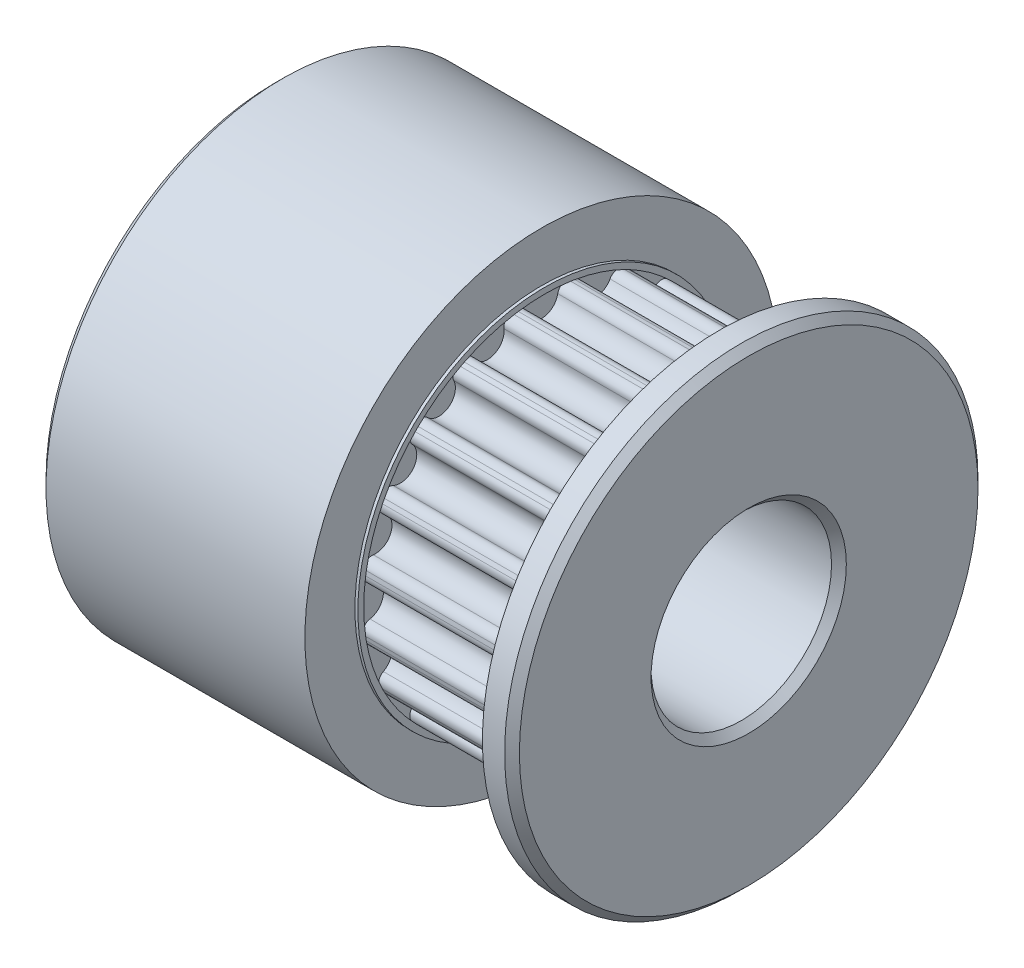
from build123d import *

# Parameters (mm, degrees)
BOSS_EXTRUDE1_DEPTH     = 6
FILLET1_R               = 0.3
SKETCH2_R               = 8
BOSS_EXTRUDE2_DEPTH     = 9
BOSS_EXTRUDE3_START     = 1
SKETCH3_R               = 8
BOSS_EXTRUDE3_DEPTH     = 1
CUT_EXTRUDE1_DEPTH      = 15.456832405
CUT_EXTRUDE1_DEPTH_BACK = 15.456832405
SKETCH4_R               = 3.05
CHAMFER1_SIZE           = 0.25
SKETCH5_R               = 1.75
CUT_EXTRUDE2_DEPTH      = 15.456832405
SKETCH6_R               = 1.75
CUT_EXTRUDE3_DEPTH      = 15.456832405
SKETCH12_R              = 6.31
SKETCH12_R_2            = 6.11
BOSS_EXTRUDE4_DEPTH     = 0.1


with BuildPart() as part:
    # Sketch1 → Boss-Extrude1 (new body)
    with BuildSketch(Plane(origin=(0, 0, 0), x_dir=(0, 0, -1), z_dir=(1, 0, 0))):
        with BuildLine():
            ThreePointArc((0.5225186, -6.087616472), (0.955814581, -6.034775761), (1.384232226, -5.951134442))
            ThreePointArc((1.384232226, -5.951134442), (1.651861295, -5.083906312), (2.378121664, -5.628200187))
            ThreePointArc((2.378121664, -5.628200187), (2.773881953, -5.444049863), (3.155484757, -5.232113908))
            ThreePointArc((3.155484757, -5.232113908), (3.142026897, -4.324629014), (4.000937611, -4.617856454))
            ThreePointArc((4.000937611, -4.617856454), (4.320422433, -4.320422433), (4.617856454, -4.000937611))
            ThreePointArc((4.617856454, -4.000937611), (4.324629014, -3.142026897), (5.232113908, -3.155484757))
            ThreePointArc((5.232113908, -3.155484757), (5.444049863, -2.773881953), (5.628200187, -2.378121664))
            ThreePointArc((5.628200187, -2.378121664), (5.083906312, -1.651861295), (5.951134442, -1.384232226))
            ThreePointArc((5.951134442, -1.384232226), (6.034775761, -0.955814581), (6.087616472, -0.5225186))
            ThreePointArc((6.087616472, -0.5225186), (5.345535439, 0), (6.087616472, 0.5225186))
            ThreePointArc((6.087616472, 0.5225186), (6.034775761, 0.955814581), (5.951134442, 1.384232226))
            ThreePointArc((5.951134442, 1.384232226), (5.083906312, 1.651861295), (5.628200187, 2.378121664))
            ThreePointArc((5.628200187, 2.378121664), (5.444049863, 2.773881953), (5.232113908, 3.155484757))
            ThreePointArc((5.232113908, 3.155484757), (4.324629014, 3.142026897), (4.617856454, 4.000937611))
            ThreePointArc((4.617856454, 4.000937611), (4.320422433, 4.320422433), (4.000937611, 4.617856454))
            ThreePointArc((4.000937611, 4.617856454), (3.142026897, 4.324629014), (3.155484757, 5.232113908))
            ThreePointArc((3.155484757, 5.232113908), (2.773881953, 5.444049863), (2.378121664, 5.628200187))
            ThreePointArc((2.378121664, 5.628200187), (1.651861295, 5.083906312), (1.384232226, 5.951134442))
            ThreePointArc((1.384232226, 5.951134442), (0.955814581, 6.034775761), (0.5225186, 6.087616472))
            ThreePointArc((0.5225186, 6.087616472), (0, 5.345535439), (-0.5225186, 6.087616472))
            ThreePointArc((-0.5225186, 6.087616472), (-0.955814581, 6.034775761), (-1.384232226, 5.951134442))
            ThreePointArc((-1.384232226, 5.951134442), (-1.651861295, 5.083906312), (-2.378121664, 5.628200187))
            ThreePointArc((-2.378121664, 5.628200187), (-2.773881953, 5.444049863), (-3.155484757, 5.232113908))
            ThreePointArc((-3.155484757, 5.232113908), (-3.142026897, 4.324629014), (-4.000937611, 4.617856454))
            ThreePointArc((-4.000937611, 4.617856454), (-4.320422433, 4.320422433), (-4.617856454, 4.000937611))
            ThreePointArc((-4.617856454, 4.000937611), (-4.324629014, 3.142026897), (-5.232113908, 3.155484757))
            ThreePointArc((-5.232113908, 3.155484757), (-5.444049863, 2.773881953), (-5.628200187, 2.378121664))
            ThreePointArc((-5.628200187, 2.378121664), (-5.083906312, 1.651861295), (-5.951134442, 1.384232226))
            ThreePointArc((-5.951134442, 1.384232226), (-6.034775761, 0.955814581), (-6.087616472, 0.5225186))
            ThreePointArc((-6.087616472, 0.5225186), (-5.345535439, 0), (-6.087616472, -0.5225186))
            ThreePointArc((-6.087616472, -0.5225186), (-6.034775761, -0.955814581), (-5.951134442, -1.384232226))
            ThreePointArc((-5.951134442, -1.384232226), (-5.083906312, -1.651861295), (-5.628200187, -2.378121664))
            ThreePointArc((-5.628200187, -2.378121664), (-5.444049863, -2.773881953), (-5.232113908, -3.155484757))
            ThreePointArc((-5.232113908, -3.155484757), (-4.324629014, -3.142026897), (-4.617856454, -4.000937611))
            ThreePointArc((-4.617856454, -4.000937611), (-4.320422433, -4.320422433), (-4.000937611, -4.617856454))
            ThreePointArc((-4.000937611, -4.617856454), (-3.142026897, -4.324629014), (-3.155484757, -5.232113908))
            ThreePointArc((-3.155484757, -5.232113908), (-2.773881953, -5.444049863), (-2.378121664, -5.628200187))
            ThreePointArc((-2.378121664, -5.628200187), (-1.651861295, -5.083906312), (-1.384232226, -5.951134442))
            ThreePointArc((-1.384232226, -5.951134442), (-0.955814581, -6.034775761), (-0.5225186, -6.087616472))
            ThreePointArc((-0.5225186, -6.087616472), (0, -5.345535439), (0.5225186, -6.087616472))
        make_face()
    extrude(amount=BOSS_EXTRUDE1_DEPTH)

    # Fillet1
    fillet1_edges = [part.edges().sort_by_distance(p)[0] for p in [
        (3, -6.087616472, 0.5225186),
        (3, -5.951134442, 1.384232226),
        (3, -5.628200187, 2.378121664),
        (3, -5.232113908, 3.155484757),
        (3, -4.617856454, 4.000937611),
        (3, -4.000937611, 4.617856454),
        (3, -3.155484757, 5.232113908),
        (3, -2.378121664, 5.628200187),
        (3, -1.384232226, 5.951134442),
        (3, -0.5225186, 6.087616472),
        (3, 0.5225186, 6.087616472),
        (3, 1.384232226, 5.951134442),
        (3, 2.378121664, 5.628200187),
        (3, 3.155484757, 5.232113908),
        (3, 4.000937611, 4.617856454),
        (3, 4.617856454, 4.000937611),
        (3, 5.232113908, 3.155484757),
        (3, 5.628200187, 2.378121664),
        (3, 5.951134442, 1.384232226),
        (3, 6.087616472, 0.5225186),
        (3, 6.087616472, -0.5225186),
        (3, 5.951134442, -1.384232226),
        (3, 5.628200187, -2.378121664),
        (3, 5.232113908, -3.155484757),
        (3, 4.617856454, -4.000937611),
        (3, 4.000937611, -4.617856454),
        (3, 3.155484757, -5.232113908),
        (3, 2.378121664, -5.628200187),
        (3, 1.384232226, -5.951134442),
        (3, 0.5225186, -6.087616472),
        (3, -0.5225186, -6.087616472),
        (3, -1.384232226, -5.951134442),
        (3, -2.378121664, -5.628200187),
        (3, -3.155484757, -5.232113908),
        (3, -4.000937611, -4.617856454),
        (3, -4.617856454, -4.000937611),
        (3, -5.232113908, -3.155484757),
        (3, -5.628200187, -2.378121664),
        (3, -5.951134442, -1.384232226),
        (3, -6.087616472, -0.5225186),
    ]]
    fillet(fillet1_edges, radius=FILLET1_R)

    # Sketch2 → Boss-Extrude2 (add)
    with BuildSketch(Plane(origin=(0, 0, 0), x_dir=(0, 0, -1), z_dir=(1, 0, 0))):
        Circle(SKETCH2_R)
    extrude(amount=-BOSS_EXTRUDE2_DEPTH)

    # Sketch3 → Boss-Extrude3 (add)
    with BuildSketch(Plane(origin=(6, 0, 0), x_dir=(0, 0, -1), z_dir=(1, 0, 0)).offset(BOSS_EXTRUDE3_START)):
        Circle(SKETCH3_R)
    extrude(amount=-BOSS_EXTRUDE3_DEPTH)

    # Sketch4 → Cut-Extrude1 (cut, two sides: drawn at the far end of the back side and taken through both)
    with BuildSketch(Plane(origin=(0, 0, 0), x_dir=(0, 0, -1), z_dir=(1, 0, 0)).offset(-CUT_EXTRUDE1_DEPTH_BACK)):
        Circle(SKETCH4_R)
    extrude(amount=CUT_EXTRUDE1_DEPTH + CUT_EXTRUDE1_DEPTH_BACK, mode=Mode.SUBTRACT)

    # Chamfer1
    chamfer1_edges = [part.edges().sort_by_distance(p)[0] for p in [
        (-9, 0, 8),
        (7, 0, 8),
        (-9, 0, 3.05),
        (7, 0, 3.05),
    ]]
    chamfer(chamfer1_edges, length=CHAMFER1_SIZE)

    # Sketch5 → Cut-Extrude2 (cut, through all)
    with BuildSketch(Plane.XY):
        with Locations((-5, 0)):
            Circle(SKETCH5_R)
    extrude(amount=-CUT_EXTRUDE2_DEPTH, mode=Mode.SUBTRACT)

    # Sketch6 → Cut-Extrude3 (cut, through all)
    with BuildSketch(Plane(origin=(0, 0, 0), x_dir=(1, 0, 0), z_dir=(0, 1, 0))):
        with Locations(Location((-5, 0, 0), (0, 0, 270))):
            Circle(SKETCH6_R)
    extrude(amount=-CUT_EXTRUDE3_DEPTH, mode=Mode.SUBTRACT)

    # Sketch12 → Boss-Extrude4 (add)
    with BuildSketch(Plane(origin=(0, 0, 0), x_dir=(0, 0, -1), z_dir=(1, 0, 0))):
        Circle(SKETCH12_R)
        Circle(SKETCH12_R_2, mode=Mode.SUBTRACT)
    extrude(amount=BOSS_EXTRUDE4_DEPTH)


solid = part.part
